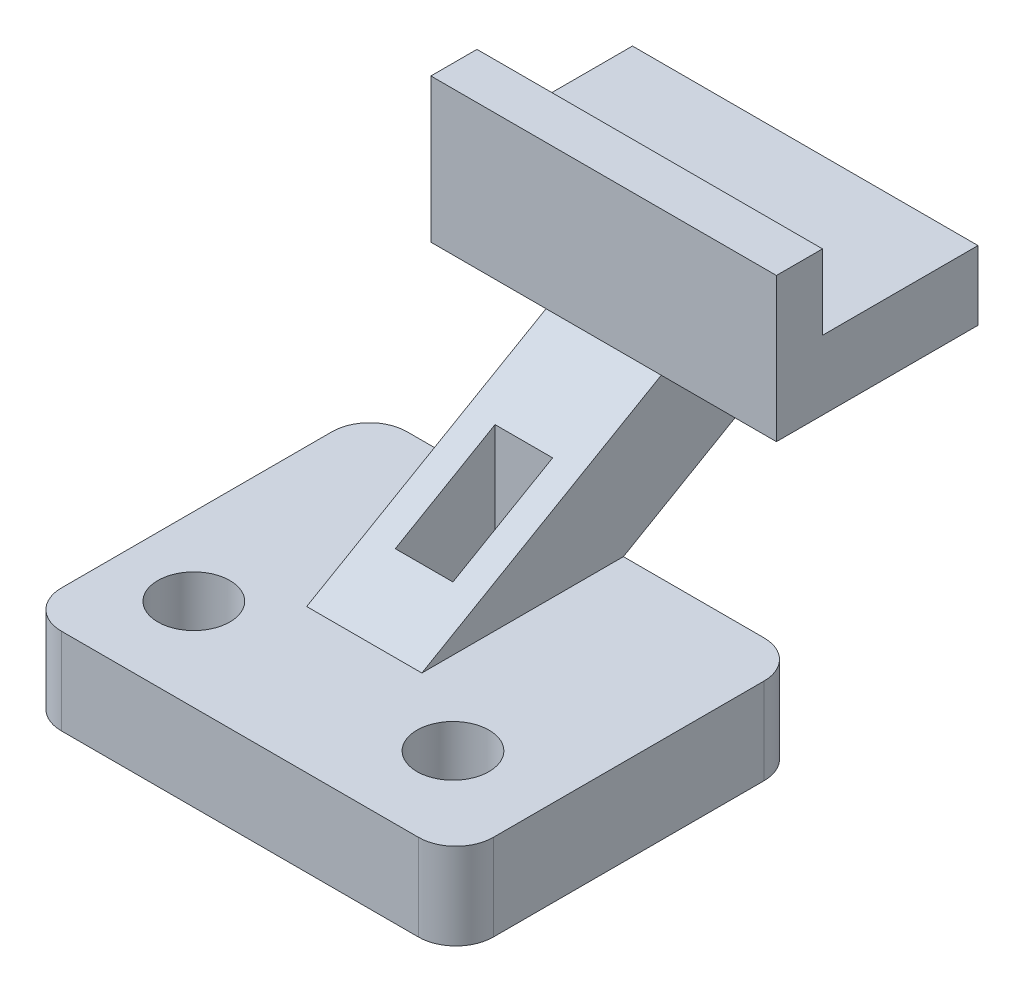
from build123d import *

# Parameters (mm, degrees)
BOSS_EXTRUDE1_DEPTH = 15
SKETCH5_R           = 6.25
CUT_EXTRUDE1_DEPTH  = 22
SKETCH7_W           = 20
SKETCH7_H           = 35
BOSS_EXTRUDE4_DEPTH = 48
SKETCH19_W          = 10
SKETCH19_H          = 20
CUT_EXTRUDE2_DEPTH  = 65
SKETCH22_W          = 60
SKETCH22_H          = 35
BOSS_EXTRUDE5_DEPTH = 12
SKETCH23_W          = 60
SKETCH23_H          = 8
BOSS_EXTRUDE6_DEPTH = 13


with BuildPart() as part:
    # Sketch3 → Boss-Extrude1 (new body)
    with BuildSketch(Plane(origin=(0, 0, 0), x_dir=(1, 0, 0), z_dir=(0, 1, 0))):
        with BuildLine():
            Line((-29.495428398, 31.401945846), (32.504571602, 31.401945846))
            ThreePointArc((32.504571602, 31.401945846), (37.100765679, 29.498139924), (39.004571602, 24.901945846))
            Line((39.004571602, 24.901945846), (39.004571602, -22.098054154))
            ThreePointArc((39.004571602, -22.098054154), (37.100765679, -26.694248232), (32.504571602, -28.598054154))
            Line((32.504571602, -28.598054154), (-29.495428398, -28.598054154))
            ThreePointArc((-29.495428398, -28.598054154), (-34.091622476, -26.694248232), (-35.995428398, -22.098054154))
            Line((-35.995428398, -22.098054154), (-35.995428398, 24.901945846))
            ThreePointArc((-35.995428398, 24.901945846), (-34.091622476, 29.498139924), (-29.495428398, 31.401945846))
        make_face()
    extrude(amount=BOSS_EXTRUDE1_DEPTH)

    # Sketch5 → Cut-Extrude1 (cut)
    with BuildSketch(Plane(origin=(0, 15, 0), x_dir=(1, 0, 0), z_dir=(0, 1, 0))):
        with Locations(Location((-22.5, -12.598054154, 0), (0, 0, 270))):
            Circle(SKETCH5_R)
        with Locations(Location((22.5, -12.598054154, 0), (0, 0, 270))):
            Circle(SKETCH5_R)
    extrude(amount=-CUT_EXTRUDE1_DEPTH, mode=Mode.SUBTRACT)

    # Sketch7 → Boss-Extrude4 (add, along a direction that is not the sketch's normal)
    with BuildSketch(Plane(origin=(0, 15, 0), x_dir=(1, 0, 0), z_dir=(0, 1, 0))):
        with Locations((-1.909590385, 13.901945846)):
            Rectangle(SKETCH7_W, SKETCH7_H)
    extrude(amount=BOSS_EXTRUDE4_DEPTH, dir=(0, 0.5000000000000001, -0.8660254037844387))

    # Sketch19 → Cut-Extrude2 (cut, along a direction that is not the sketch's normal)
    with BuildSketch(Plane(origin=(0, 12.808003151, 7.394704067), x_dir=(1, 0, 0), z_dir=(0, 0.8660254037844377, 0.5000000000000016))):
        with Locations((-1.909590385, 26.383993698)):
            Rectangle(SKETCH19_W, SKETCH19_H)
    extrude(amount=-CUT_EXTRUDE2_DEPTH, dir=(0, 1, 0), mode=Mode.SUBTRACT)

    # Sketch22 → Boss-Extrude5 (add)
    with BuildSketch(Plane(origin=(0, 39, 0), x_dir=(1, 0, 0), z_dir=(0, 1, 0))):
        with Locations((-1.909590385, 55.471165228)):
            Rectangle(SKETCH22_W, SKETCH22_H)
    extrude(amount=BOSS_EXTRUDE5_DEPTH)

    # Sketch23 → Boss-Extrude6 (add)
    with BuildSketch(Plane(origin=(0, 51, 0), x_dir=(1, 0, 0), z_dir=(0, 1, 0))):
        with Locations((-1.909590385, 41.971165228)):
            Rectangle(SKETCH23_W, SKETCH23_H)
    extrude(amount=BOSS_EXTRUDE6_DEPTH)


solid = part.part
